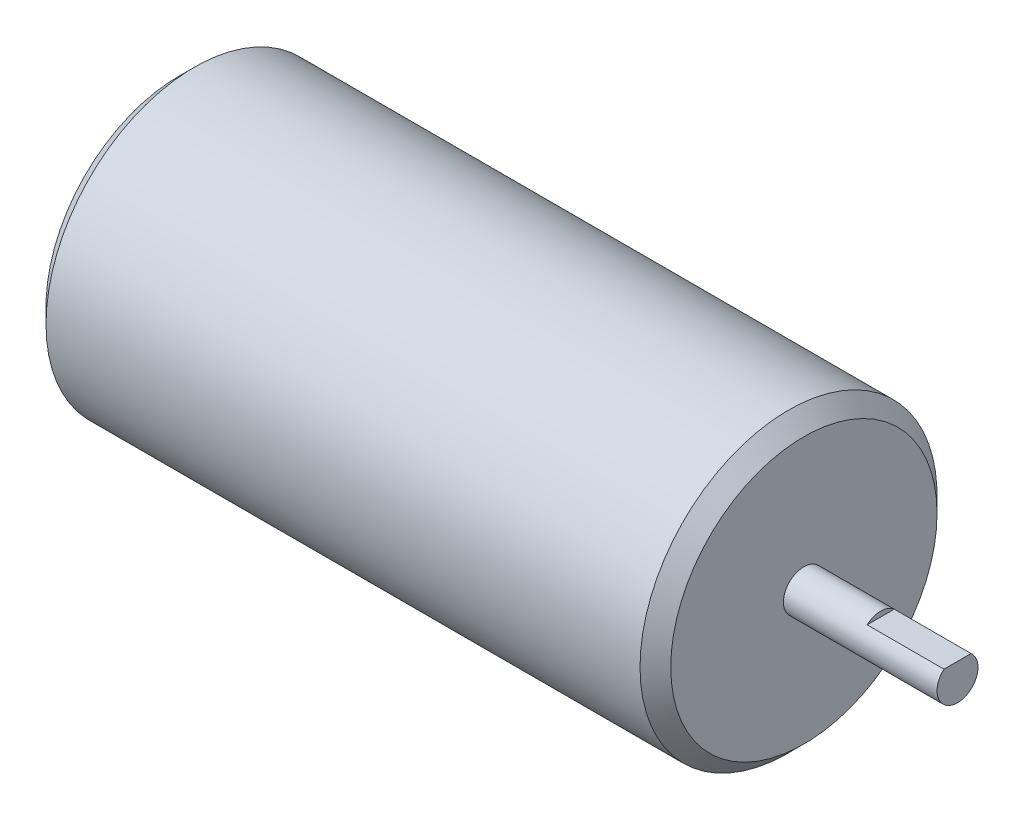
from build123d import *

# Parameters (mm, degrees)
SKETCH_1_R          = 29
EXTRUDE_1_DEPTH     = 122
CHAMFER_1_SIZE      = 3
SKETCH_2_R          = 4
EXTRUDE_2_DEPTH     = 30
CUT_EXTRUDE_START   = -15
CUT_EXTRUDE_1_DEPTH = 15


with BuildPart() as part:
    # Эскиз1 → Бобышка-Вытянуть1 (new body)
    with BuildSketch(Plane(origin=(0, 0, 0), x_dir=(0, 0, -1), z_dir=(1, 0, 0))):
        with Locations(Location((0, 0, 0), (0, 0, 180))):
            Circle(SKETCH_1_R)
    extrude(amount=EXTRUDE_1_DEPTH)

    # Фаска1
    chamfer_1_edges = [part.edges().sort_by_distance(p)[0] for p in [
        (0, 0, -29),
        (122, 0, -29),
    ]]
    chamfer(chamfer_1_edges, length=CHAMFER_1_SIZE)

    # Эскиз2 → Бобышка-Вытянуть2 (add)
    with BuildSketch(Plane(origin=(122, 0, 0), x_dir=(0, 0, -1), z_dir=(1, 0, 0))):
        Circle(SKETCH_2_R)
    extrude(amount=EXTRUDE_2_DEPTH)

    # Эскиз3 → Вырез-Вытянуть1 (cut)
    with BuildSketch(Plane(origin=(152, 0, 0), x_dir=(0, 0, -1), z_dir=(1, 0, 0)).offset(CUT_EXTRUDE_START)):
        with BuildLine():
            Line((-2.645751311, 3), (2.645751311, 3))
            ThreePointArc((2.645751311, 3), (0, 4), (-2.645751311, 3))
        make_face()
    extrude(amount=CUT_EXTRUDE_1_DEPTH, mode=Mode.SUBTRACT)


solid = part.part
